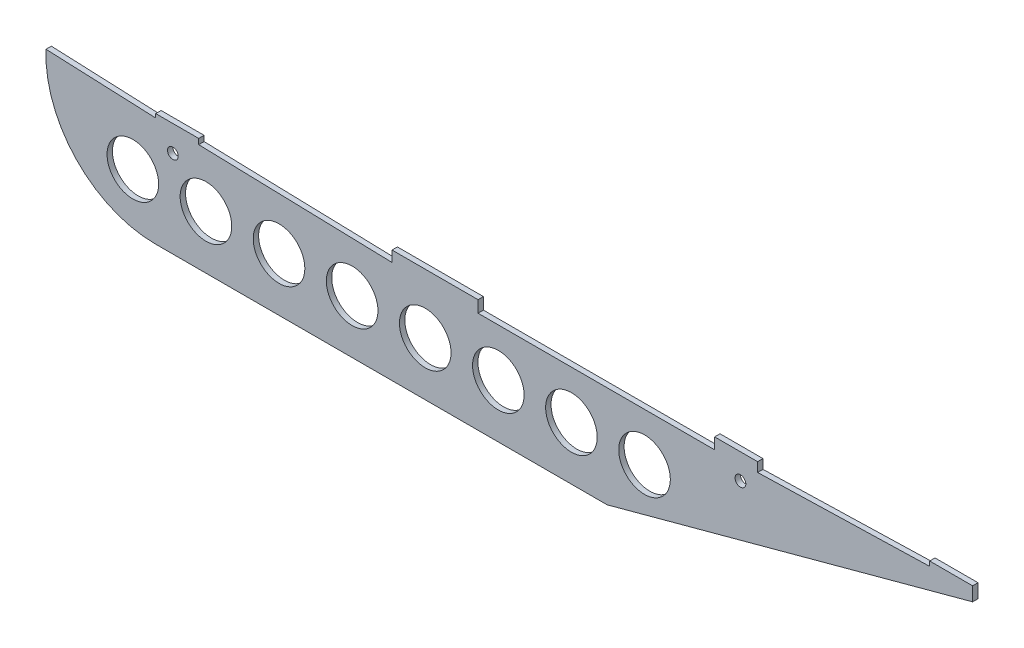
from build123d import *

# Parameters (mm, degrees)
BOSS_EXTRUDE1_DEPTH      = 1.5875
BOSS_EXTRUDE1_DEPTH_BACK = 1.5875
CUT_EXTRUDE1_DEPTH       = 552.50665189
CUT_EXTRUDE1_DEPTH_BACK  = 552.50665189
SKETCH2_R                = 3.175
CUT_EXTRUDE2_DEPTH       = 2.54
CUT_EXTRUDE2_DEPTH_BACK  = 2.54
SKETCH3_R                = 15.24


with BuildPart() as part:
    # Sketch1 → Boss-Extrude1 (new, two sides: drawn at the far end of the back side and taken through both)
    with BuildSketch(Plane.XY.offset(-BOSS_EXTRUDE1_DEPTH_BACK)):
        with BuildLine():
            Line((331.479240226, -67.327812174), (547.379240226, -9.015530032))
            Line((547.379240226, -9.015530032), (547.379240226, -0.80358759))
            Line((547.379240226, -0.80358759), (521.979240226, -0.80358759))
            Line((521.979240226, -0.80358759), (521.979240226, -3.550327588))
            Line((521.979240226, -3.550327588), (420.379240226, -6.318039604))
            Line((420.379240226, -6.318039604), (420.379240226, -0.80358759))
            Line((420.379240226, -0.80358759), (394.979240226, -0.80358759))
            Line((394.979240226, -0.80358759), (394.979240226, -7.4329025))
            Line((394.979240226, -7.4329025), (255.21408059, -7.4329025))
            Line((255.21408059, -7.4329025), (255.21408059, -0.503629592))
            Line((255.21408059, -0.503629592), (204.41408059, -0.503629592))
            Line((204.41408059, -0.503629592), (204.41408059, -6.875812174))
            Line((204.41408059, -6.875812174), (90.223191735, -3.707270632))
            Line((90.223191735, -3.707270632), (90.223191735, -0.503629592))
            Line((90.223191735, -0.503629592), (64.823191735, -0.503629592))
            Line((64.823191735, -0.503629592), (64.823191735, -2.772070572))
            Line((64.823191735, -2.772070572), (0, 0))
            ThreePointArc((0, 0), (17.887759649, -47.42996384), (64.510168925, -67.327812174))
            Line((64.510168925, -67.327812174), (331.479240226, -67.327812174))
        make_face()
    extrude(amount=BOSS_EXTRUDE1_DEPTH + BOSS_EXTRUDE1_DEPTH_BACK)

    # Sketch2 → Cut-Extrude1 (cut, two sides: drawn at the far end of the back side and taken through both)
    with BuildSketch(Plane.XY.offset(-CUT_EXTRUDE1_DEPTH_BACK)):
        with Locations((410.219240226, -15.743629592)):
            Circle(SKETCH2_R)
        with Locations((74.939240226, -15.743629592)):
            Circle(SKETCH2_R)
    extrude(amount=CUT_EXTRUDE1_DEPTH + CUT_EXTRUDE1_DEPTH_BACK, mode=Mode.SUBTRACT)

    # Sketch3 → Cut-Extrude2 (cut, two sides: drawn at the far end of the back side and taken through both)
    with BuildSketch(Plane.XY.offset(-CUT_EXTRUDE2_DEPTH_BACK)):
        with BuildLine():
            ThreePointArc((79.242840924, -35.710884581), (94.482840924, -50.950884581), (109.722840924, -35.710884581))
            Line((109.722840924, -35.710884581), (79.242840924, -35.710884581))
        make_face()
        with BuildLine():
            Line((79.242840924, -35.710884581), (109.722840924, -35.710884581))
            ThreePointArc((109.722840924, -35.710884581), (94.482840924, -20.470884581), (79.242840924, -35.710884581))
        make_face()
        with BuildLine():
            ThreePointArc((368.802840924, -35.710884581), (353.562840924, -20.470884581), (338.322840924, -35.710884581))
            ThreePointArc((338.322840924, -35.710884581), (353.562840924, -50.950884581), (368.802840924, -35.710884581))
        make_face()
        with Locations((51.302840924, -35.710884581)):
            Circle(SKETCH3_R)
        with Locations((137.662840924, -35.710884581)):
            Circle(SKETCH3_R)
        with Locations((180.842840924, -35.710884581)):
            Circle(SKETCH3_R)
        with Locations((224.022840924, -35.710884581)):
            Circle(SKETCH3_R)
        with Locations((267.202840924, -35.710884581)):
            Circle(SKETCH3_R)
        with Locations((310.382840924, -35.710884581)):
            Circle(SKETCH3_R)
    extrude(amount=CUT_EXTRUDE2_DEPTH + CUT_EXTRUDE2_DEPTH_BACK, mode=Mode.SUBTRACT)


solid = part.part
